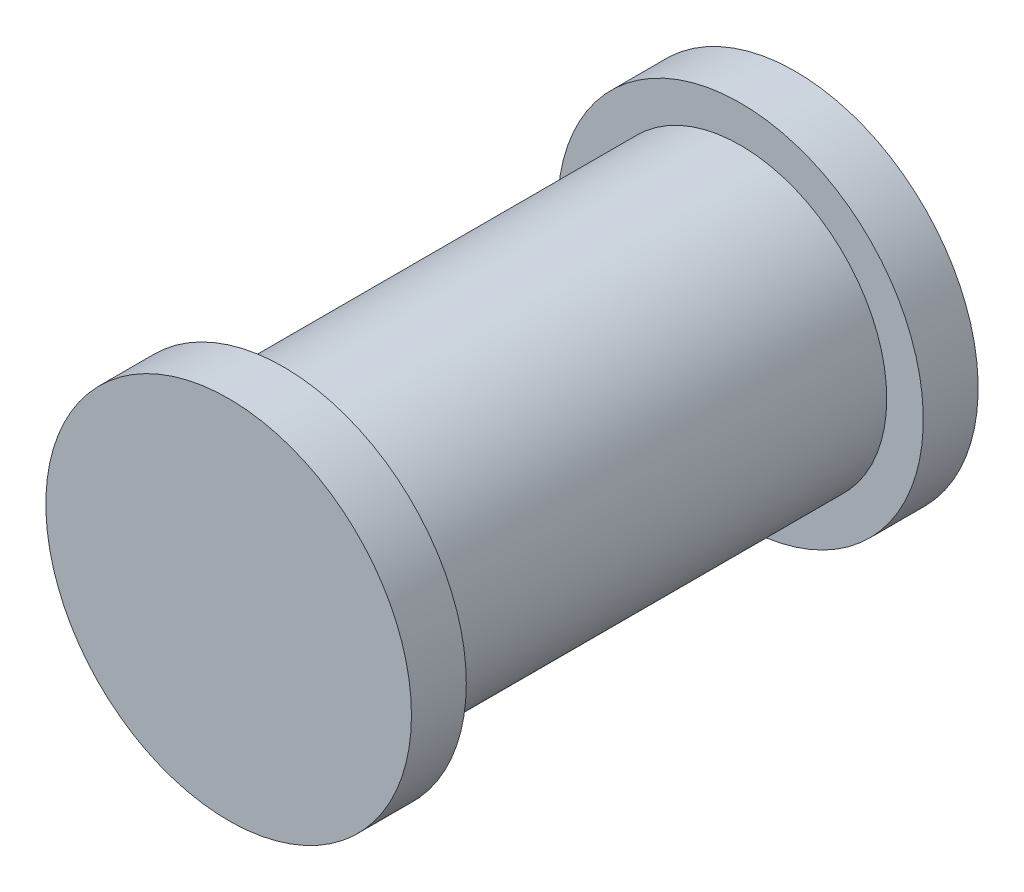
from build123d import *

# Parameters (mm, degrees)
SKETCH_1_R      = 8
EXTRUDE_3_DEPTH = 25
SKETCH_3_R      = 10
EXTRUDE_4_DEPTH = 3
EXTRUDE_START   = 3
SKETCH_4_R      = 10
EXTRUDE_5_DEPTH = 3


with BuildPart() as part:
    # 草图1 → 凸台-拉伸3 (new body)
    with BuildSketch(Plane.XY):
        Circle(SKETCH_1_R)
    extrude(amount=EXTRUDE_3_DEPTH)

    # 草图3 → 凸台-拉伸4 (add)
    with BuildSketch(Plane.XY.offset(25)):
        Circle(SKETCH_3_R)
    extrude(amount=EXTRUDE_4_DEPTH)

    # 草图4 → 凸台-拉伸5 (add)
    with BuildSketch(Plane(origin=(0, 0, 0), x_dir=(-1, 0, 0), z_dir=(0, 0, -1)).offset(EXTRUDE_START)):
        with Locations(Location((0, 0, 0), (0, 0, 180))):
            Circle(SKETCH_4_R)
    extrude(amount=-EXTRUDE_5_DEPTH)


solid = part.part
